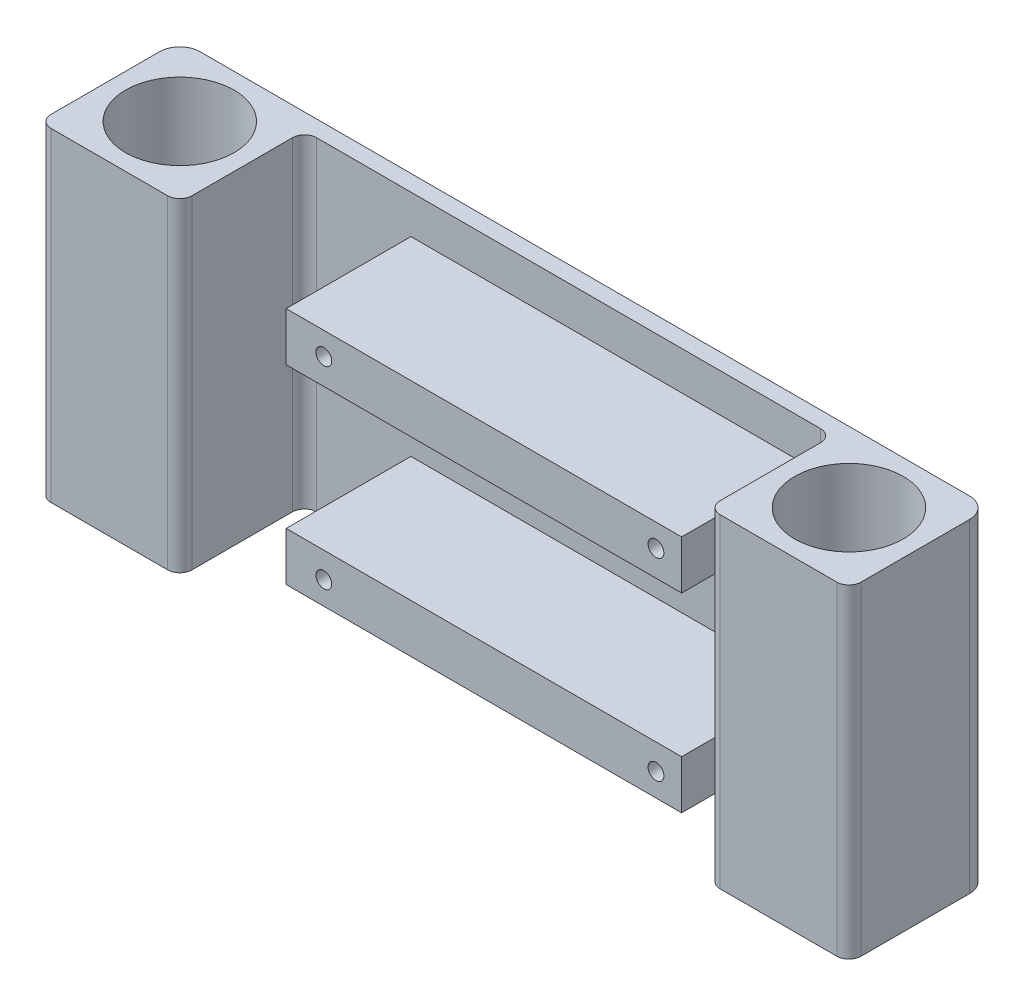
from build123d import *

# Parameters (mm, degrees)
SKETCH1_R           = 13.4
BOSS_EXTRUDE1_DEPTH = 80
FILLET1_R           = 5
FILLET2_R           = 3
FILLET3_R           = 3
SKETCH2_W           = 97.626120272
SKETCH2_H           = 12
SKETCH2_R           = 1.95
BOSS_EXTRUDE2_DEPTH = 30.8


with BuildPart() as part:
    # Sketch1 → Boss-Extrude1 (new body)
    with BuildSketch(Plane(origin=(0, 0, 0), x_dir=(1, 0, 0), z_dir=(0, 1, 0))):
        Polygon((-17.4, 17.4), (17.4, 17.4), (82.6, 17.4), (82.6, 13.4), (17.4, 13.4), (17.4, -17.4), (-17.4, -17.4), align=None)
        with Locations(Location((0, 0, 0), (0, 0, 270))):
            Circle(SKETCH1_R, mode=Mode.SUBTRACT)
    boss_extrude1 = extrude(amount=BOSS_EXTRUDE1_DEPTH)

    # Mirror3: Boss-Extrude1 across plane
    add(boss_extrude1.mirror(Plane(origin=(82.6, 80, 0), x_dir=(0, 0, 1), z_dir=(1, 0, 0))))

    # Fillet1
    fillet1_edges = [part.edges().sort_by_distance(p)[0] for p in [
        (-17.4, 40, -17.4),
        (182.6, 40, -17.4),
    ]]
    fillet(fillet1_edges, radius=FILLET1_R)

    # Fillet2
    fillet2_edges = [part.edges().sort_by_distance(p)[0] for p in [
        (17.4, 40, 17.4),
        (-17.4, 40, 17.4),
        (147.8, 40, 17.4),
        (182.6, 40, 17.4),
    ]]
    fillet(fillet2_edges, radius=FILLET2_R)

    # Fillet3
    fillet3_edges = [part.edges().sort_by_distance(p)[0] for p in [
        (17.4, 40, -13.4),
        (147.8, 40, -13.4),
    ]]
    fillet(fillet3_edges, radius=FILLET3_R)

    # Sketch2 → Boss-Extrude2 (add)
    # profile 1 of 2: a face of its own
    with BuildSketch(Plane.XY.offset(-13.4)):
        with Locations((92.472437585, 17.5)):
            Rectangle(SKETCH2_W, SKETCH2_H)
        with Locations((52.955461896, 17.190605429)):
            Circle(SKETCH2_R, mode=Mode.SUBTRACT)
        with Locations((134.955461896, 17.190605429)):
            Circle(SKETCH2_R, mode=Mode.SUBTRACT)
    # profile 2 of 2: a face of its own
    with BuildSketch(Plane.XY.offset(-13.4)):
        with Locations((92.472437585, 64.5)):
            Rectangle(SKETCH2_W, SKETCH2_H)
        with Locations((52.955461896, 64.890605429)):
            Circle(SKETCH2_R, mode=Mode.SUBTRACT)
        with Locations((134.955461896, 64.890605429)):
            Circle(SKETCH2_R, mode=Mode.SUBTRACT)
    extrude(amount=BOSS_EXTRUDE2_DEPTH)


solid = part.part
